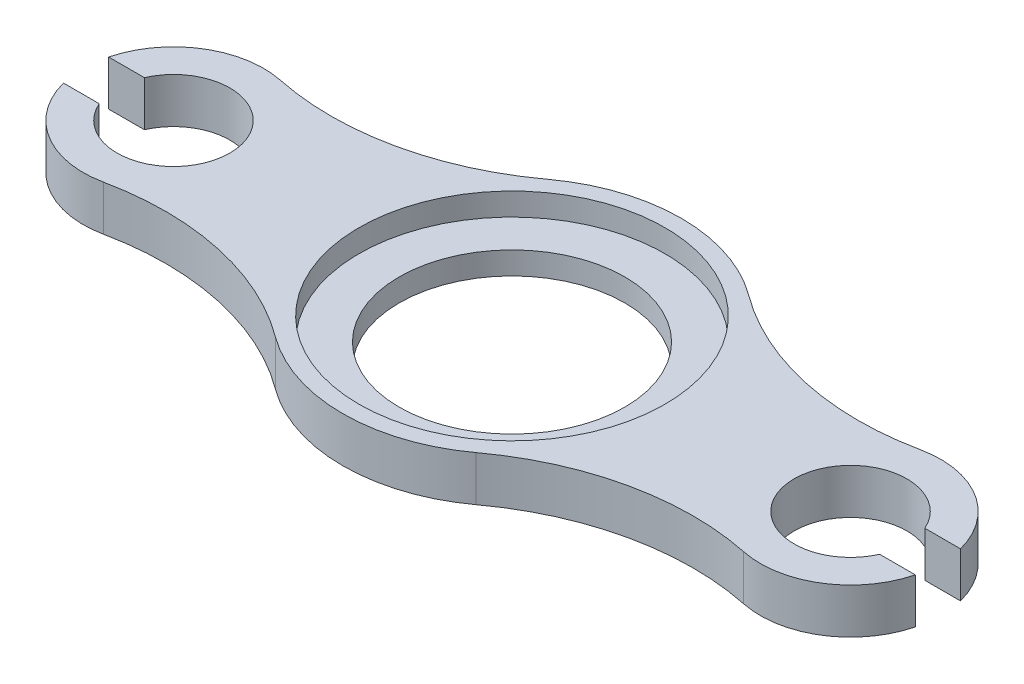
from build123d import *

# Parameters (mm, degrees)
Y_KSEKLIK_EKSTR_ZYON4_DEPTH = 20
IZIM5_R                     = 67.8
IZIM5_R_2                   = 50
KES_EKSTR_ZYON1_DEPTH       = 10
IZIM7_R                     = 50
KES_EKSTR_ZYON2_DEPTH       = 20


with BuildPart() as part:
    # Çizim1 → Yükseklik-Ekstrüzyon4 (new body)
    with BuildSketch(Plane(origin=(0, 0, 0), x_dir=(1, 0, 0), z_dir=(0, 1, 0))):
        with BuildLine():
            ThreePointArc((-141.825379968, 39.155786128), (-171.116823462, 33.971749541), (-188.729833462, 10))
            Line((-188.729833462, 10), (-172.912878475, 10))
            ThreePointArc((-172.912878475, 10), (-125, 0), (-172.912878475, -10))
            Line((-172.912878475, -10), (-188.729833462, -10))
            ThreePointArc((-188.729833462, -10), (-171.116823462, -33.971749541), (-141.825379968, -39.155786128))
            ThreePointArc((-141.825379968, -39.155786128), (-90.896626459, -39.380855183), (-44.495770634, -60.374882159))
            ThreePointArc((-44.495770634, -60.374882159), (0, -75), (44.495770634, -60.374882159))
            ThreePointArc((44.495770634, -60.374882159), (90.896626459, -39.380855183), (141.825379968, -39.155786128))
            ThreePointArc((141.825379968, -39.155786128), (171.116823462, -33.971749541), (188.729833462, -10))
            Line((188.729833462, -10), (172.912878475, -10))
            ThreePointArc((172.912878475, -10), (125, 0), (172.912878475, 10))
            Line((172.912878475, 10), (188.729833462, 10))
            ThreePointArc((188.729833462, 10), (171.116823462, 33.971749541), (141.825379968, 39.155786128))
            ThreePointArc((141.825379968, 39.155786128), (90.896626459, 39.380855183), (44.495770634, 60.374882159))
            ThreePointArc((44.495770634, 60.374882159), (0, 75), (-44.495770634, 60.374882159))
            ThreePointArc((-44.495770634, 60.374882159), (-90.896626459, 39.380855183), (-141.825379968, 39.155786128))
        make_face()
    extrude(amount=Y_KSEKLIK_EKSTR_ZYON4_DEPTH)

    # Çizim5 → Kes-Ekstrüzyon1 (cut)
    with BuildSketch(Plane(origin=(0, 20, 0), x_dir=(1, 0, 0), z_dir=(0, 1, 0))):
        with Locations(Location((0, 0, 0), (0, 0, 270))):
            Circle(IZIM5_R)
        with Locations(Location((0, 0, 0), (0, 0, 270))):
            Circle(IZIM5_R_2, mode=Mode.SUBTRACT)
    extrude(amount=-KES_EKSTR_ZYON1_DEPTH, mode=Mode.SUBTRACT)

    # Çizim7 → Kes-Ekstrüzyon2 (cut)
    with BuildSketch(Plane(origin=(0, 20, 0), x_dir=(1, 0, 0), z_dir=(0, 1, 0))):
        with Locations(Location((0, 0, 0), (0, 0, 270))):
            Circle(IZIM7_R)
    extrude(amount=-KES_EKSTR_ZYON2_DEPTH, mode=Mode.SUBTRACT)


solid = part.part
